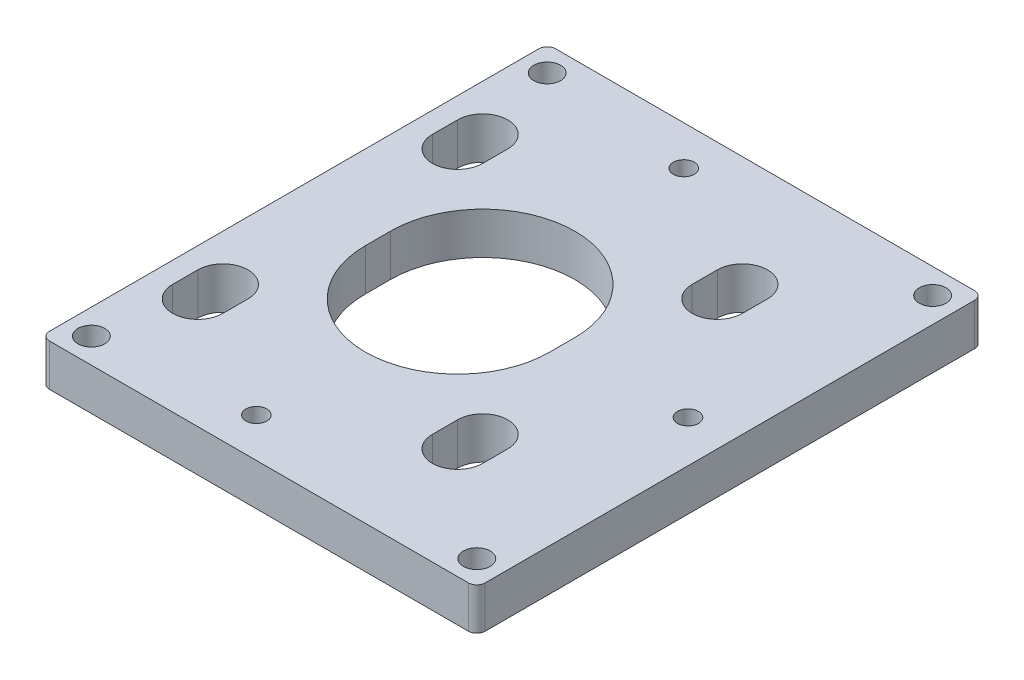
from build123d import *

# Parameters (mm, degrees)
SKETCH1_W                   = 52
SKETCH1_H                   = 60.4
BOSS_EXTRUDE1_DEPTH         = 5
M3_CLEARANCE_HOLE1_D        = 3.2
TAP_DRILL_FOR_M3X0_5_TAP1_D = 2.5
FILLET1_R                   = 1


with BuildPart() as part:
    # Sketch1 → Boss-Extrude1 (new body)
    with BuildSketch(Plane(origin=(0, 0, 0), x_dir=(1, 0, 0), z_dir=(0, 1, 0))):
        with Locations((5, 0)):
            Rectangle(SKETCH1_W, SKETCH1_H)
        with BuildLine():
            Line((-11, -1.5), (-11, 1.5))
            ThreePointArc((-11, 1.5), (0, 12.5), (11, 1.5))
            Line((11, 1.5), (11, -1.5))
            ThreePointArc((11, -1.5), (0, -12.5), (-11, -1.5))
        make_face(mode=Mode.SUBTRACT)
        with BuildLine():
            Line((-18.5, 14), (-18.5, 17))
            ThreePointArc((-18.5, 17), (-15.5, 20), (-12.5, 17))
            Line((-12.5, 17), (-12.5, 14))
            ThreePointArc((-12.5, 14), (-15.5, 11), (-18.5, 14))
        make_face(mode=Mode.SUBTRACT)
        with BuildLine():
            Line((12.5, 14), (12.5, 17))
            ThreePointArc((12.5, 17), (15.5, 20), (18.5, 17))
            Line((18.5, 17), (18.5, 14))
            ThreePointArc((18.5, 14), (15.5, 11), (12.5, 14))
        make_face(mode=Mode.SUBTRACT)
        with BuildLine():
            Line((12.5, -17), (12.5, -14))
            ThreePointArc((12.5, -14), (15.5, -11), (18.5, -14))
            Line((18.5, -14), (18.5, -17))
            ThreePointArc((18.5, -17), (15.5, -20), (12.5, -17))
        make_face(mode=Mode.SUBTRACT)
        with BuildLine():
            Line((-18.5, -17), (-18.5, -14))
            ThreePointArc((-18.5, -14), (-15.5, -11), (-12.5, -14))
            Line((-12.5, -14), (-12.5, -17))
            ThreePointArc((-12.5, -17), (-15.5, -20), (-18.5, -17))
        make_face(mode=Mode.SUBTRACT)
    extrude(amount=BOSS_EXTRUDE1_DEPTH)

    # M3 Clearance Hole1 (through all)
    with Locations(Plane(origin=(0, 5, 0), x_dir=(1, 0, 0), z_dir=(0, 1, 0))):
        with Locations((-18, -27.2), (28, -27.2), (28, 27.2), (-18, 27.2)):
            Hole(M3_CLEARANCE_HOLE1_D / 2)

    # Tap Drill for M3x0.5 Tap1 (through all)
    with Locations(Plane(origin=(0, 5, 0), x_dir=(1, 0, 0), z_dir=(0, 1, 0))):
        with Locations((26, 0), (0, 25.5), (0, -25.5)):
            Hole(TAP_DRILL_FOR_M3X0_5_TAP1_D / 2)

    # Fillet1
    fillet1_edges = [part.edges().sort_by_distance(p)[0] for p in [
        (-21, 2.5, -30.2),
        (31, 2.5, -30.2),
        (31, 2.5, 30.2),
        (-21, 2.5, 30.2),
    ]]
    fillet(fillet1_edges, radius=FILLET1_R)


solid = part.part
